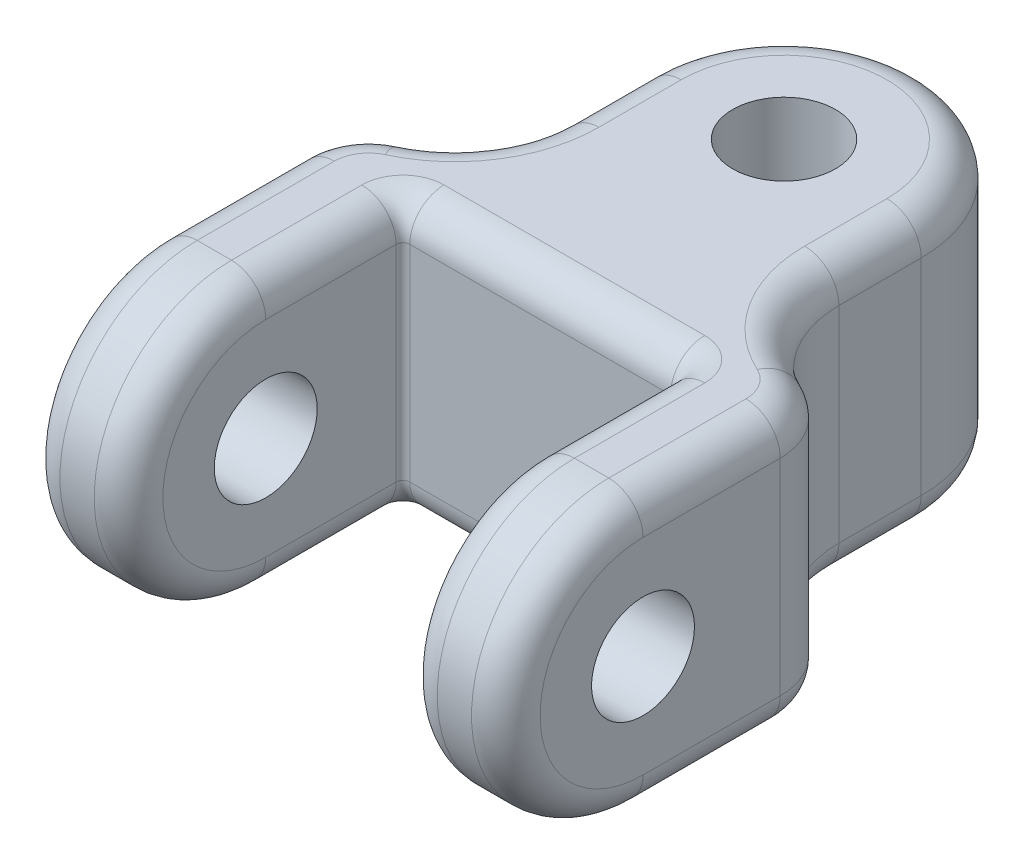
from build123d import *

# Parameters (mm, degrees)
BOSS_EXTRUDE1_DEPTH = 20
FILLET1_RADIUS      = 20
FILLET1_LENGTH      = 15
FILLET2_RADIUS      = 20
FILLET2_LENGTH      = 15
SKETCH2_R           = 7.5
CUT_EXTRUDE1_DEPTH  = 121.130824808
SKETCH3_R           = 7.5
CUT_EXTRUDE2_DEPTH  = 110.345393451
FILLET3_R           = 1
FILLET4_R           = 5


with BuildPart() as part:
    # Sketch1 → Boss-Extrude1 (new, symmetric)
    with BuildSketch(Plane(origin=(0, 0, 0), x_dir=(1, 0, 0), z_dir=(0, 1, 0))):
        with BuildLine():
            Line((-20, 40), (-20, 0))
            Line((-20, 0), (-35, 0))
            Line((-35, 0), (-35, 40))
            ThreePointArc((-35, 40), (-33.435273923, 45.370861555), (-29.230769231, 49.060937684))
            ThreePointArc((-29.230769231, 49.060937684), (-22.503561723, 54.96505949), (-20, 63.558437979))
            Line((-20, 63.558437979), (-20, 75.558437979))
            ThreePointArc((-20, 75.558437979), (0, 95.558437979), (20, 75.558437979))
            Line((20, 75.558437979), (20, 63.558437979))
            ThreePointArc((20, 63.558437979), (22.503561723, 54.96505949), (29.230769231, 49.060937684))
            ThreePointArc((29.230769231, 49.060937684), (33.435273923, 45.370861555), (35, 40))
            Line((35, 40), (35, 0))
            Line((35, 0), (20, 0))
            Line((20, 0), (20, 40))
            Line((20, 40), (-20, 40))
        make_face()
    extrude(amount=BOSS_EXTRUDE1_DEPTH, both=True)

    # Fillet1: full round fillet: the end face becomes a half cylinder, R = half its width
    fillet1_face = Plane((-27.5, 0, 0), x_dir=(1, 0, 0), z_dir=(0, 0, 1))  # on the end face: x along it, z out of the body
    fillet1_slab = fillet1_face.offset(-FILLET1_RADIUS / 2) * Box(FILLET1_LENGTH, 2 * FILLET1_RADIUS, FILLET1_RADIUS, mode=Mode.PRIVATE)  # the body's end, R deep
    fillet1_round = Plane((-27.5, 0, -20), x_dir=(0, 0, 1), z_dir=(1, 0, 0)) * Cylinder(FILLET1_RADIUS, FILLET1_LENGTH, mode=Mode.PRIVATE)  # its axis R under the face
    add(fillet1_slab - fillet1_round, mode=Mode.SUBTRACT)

    # Fillet2: full round fillet: the end face becomes a half cylinder, R = half its width
    fillet2_face = Plane((27.5, 0, 0), x_dir=(-1, 0, 0), z_dir=(0, 0, 1))  # on the end face: x along it, z out of the body
    fillet2_slab = fillet2_face.offset(-FILLET2_RADIUS / 2) * Box(FILLET2_LENGTH, 2 * FILLET2_RADIUS, FILLET2_RADIUS, mode=Mode.PRIVATE)  # the body's end, R deep
    fillet2_round = Plane((27.5, 0, -20), x_dir=(0, 0, 1), z_dir=(-1, 0, 0)) * Cylinder(FILLET2_RADIUS, FILLET2_LENGTH, mode=Mode.PRIVATE)  # its axis R under the face
    add(fillet2_slab - fillet2_round, mode=Mode.SUBTRACT)

    # Sketch2 → Cut-Extrude1 (cut, through all)
    with BuildSketch(Plane(origin=(35, 0, 0), x_dir=(0, 0, -1), z_dir=(1, 0, 0))):
        with Locations((20, 0)):
            Circle(SKETCH2_R)
    extrude(amount=-CUT_EXTRUDE1_DEPTH, mode=Mode.SUBTRACT)

    # Sketch3 → Cut-Extrude2 (cut, through all)
    with BuildSketch(Plane(origin=(0, 20, 0), x_dir=(1, 0, 0), z_dir=(0, 1, 0))):
        with Locations(Location((0, 75.558437979, 0), (0, 0, 270))):
            Circle(SKETCH3_R)
    extrude(amount=-CUT_EXTRUDE2_DEPTH, mode=Mode.SUBTRACT)

    # Fillet3
    fillet3_edges = [part.edges().sort_by_distance(p)[0] for p in [
        (-20, 0, -40),
        (20, 0, -40),
    ]]
    fillet(fillet3_edges, radius=FILLET3_R)

    # Fillet4
    fillet4_edges = [part.edges().sort_by_distance(p)[0] for p in [
        (-35, -20, -30),
        (-33.435273923, -20, -45.370861555),
        (-22.503561723, -20, -54.96505949),
        (-20, -20, -69.558437979),
        (0, -20, -95.558437979),
        (20, -20, -69.558437979),
        (22.503561723, -20, -54.96505949),
        (33.435273923, -20, -45.370861555),
        (33.435273923, 20, -45.370861555),
        (22.503561723, 20, -54.96505949),
        (20, 20, -69.558437979),
        (0, 20, -95.558437979),
        (-20, 20, -69.558437979),
        (-20, 20, -29.5),
        (-20, -20, -29.5),
        (-22.503561723, 20, -54.96505949),
        (-35, 0, 0),
        (-20, 0, 0),
        (-33.435273923, 20, -45.370861555),
        (35, 20, -30),
        (35, -20, -30),
        (-35, 20, -30),
        (20, 0, 0),
        (35, 0, 0),
        (20, -20, -29.5),
        (20, 20, -29.5),
        (0, -20, -40),
        (0, 20, -40),
        (19.707106781, -20, -39.707106781),
        (19.707106781, 20, -39.707106781),
        (-19.707106781, -20, -39.707106781),
        (-19.707106781, 20, -39.707106781),
    ]]
    fillet(fillet4_edges, radius=FILLET4_R)


solid = part.part
